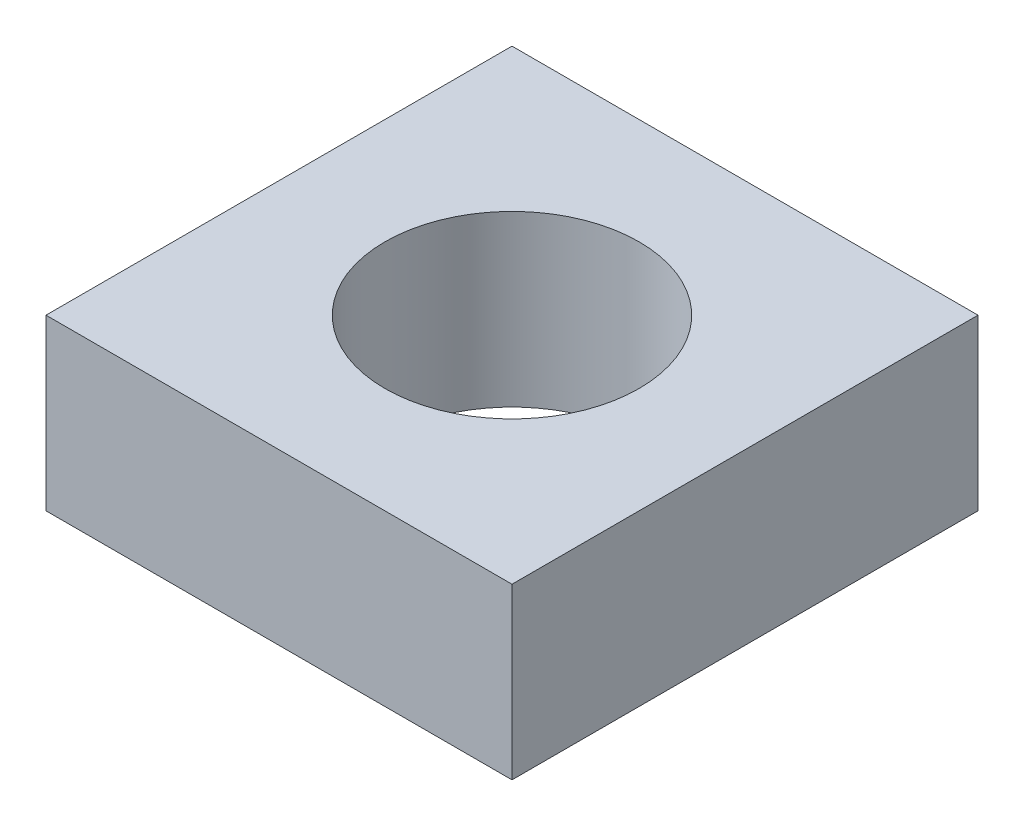
from build123d import *

# Parameters (mm, degrees)
SKETCH_1_W      = 5.5
SKETCH_1_H      = 5.5
SKETCH_1_R      = 1.5
EXTRUDE_1_DEPTH = 2


with BuildPart() as part:
    # 草图1 → 凸台-拉伸1 (new body)
    with BuildSketch(Plane(origin=(0, 0, 0), x_dir=(1, 0, 0), z_dir=(0, 1, 0))):
        Rectangle(SKETCH_1_W, SKETCH_1_H)
        with Locations(Location((0, 0, 0), (0, 0, 270))):
            Circle(SKETCH_1_R, mode=Mode.SUBTRACT)
    extrude(amount=EXTRUDE_1_DEPTH)


solid = part.part
